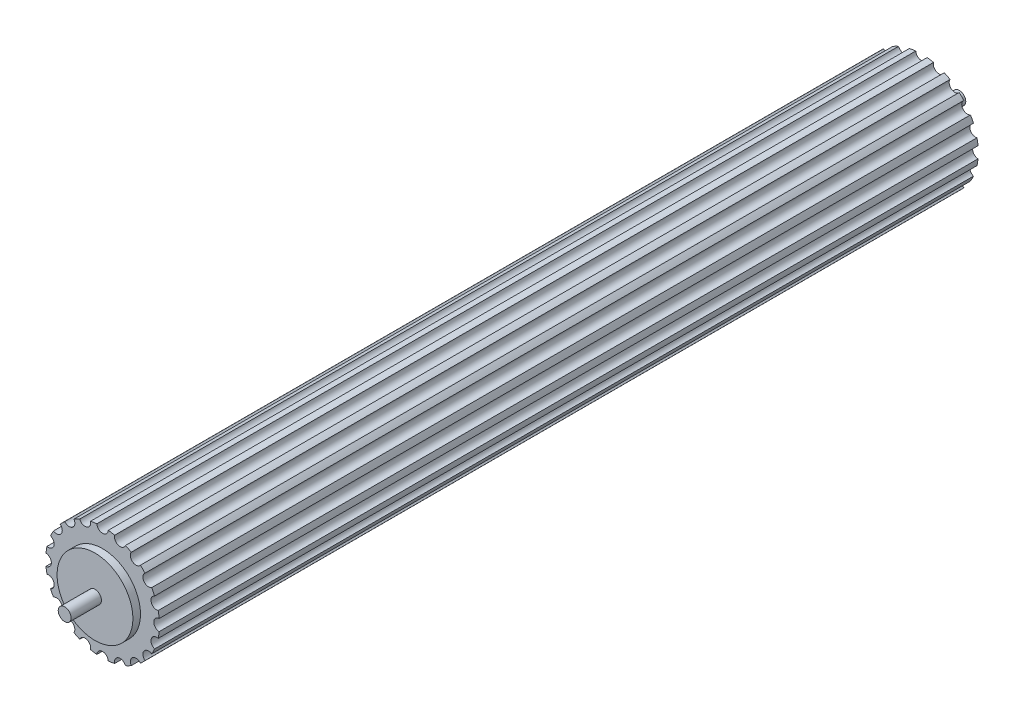
from build123d import *

# Parameters (mm, degrees)
IZIM1_R                     = 75
Y_KSEKLIK_EKSTR_ZYON1_DEPTH = 1080
IZIM2_R                     = 8.5
Y_KSEKLIK_EKSTR_ZYON2_DEPTH = 50
IZIM3_R                     = 50
Y_KSEKLIK_EKSTR_ZYON3_DEPTH = 10
IZIM4_R                     = 7.5
KES_EKSTR_ZYON1_DEPTH       = 1135.966959872
DAIRESEL_KAPLAMA1_COUNT     = 20


with BuildPart() as part:
    # Çizim1 → Yükseklik-Ekstrüzyon1 (new body)
    with BuildSketch(Plane.XY):
        Circle(IZIM1_R)
    extrude(amount=Y_KSEKLIK_EKSTR_ZYON1_DEPTH)

    # Çizim2 → Yükseklik-Ekstrüzyon2 (add)
    with BuildSketch(Plane.XY.offset(1080)):
        Circle(IZIM2_R)
    y_kseklik_ekstr_zyon2 = extrude(amount=Y_KSEKLIK_EKSTR_ZYON2_DEPTH)

    # Aynalama1: Yükseklik-Ekstrüzyon2 across plane
    add(y_kseklik_ekstr_zyon2.mirror(Plane.XY.offset(540)))

    # Çizim3 → Yükseklik-Ekstrüzyon3 (add)
    with BuildSketch(Plane.XY.offset(1080)):
        Circle(IZIM3_R)
    y_kseklik_ekstr_zyon3 = extrude(amount=Y_KSEKLIK_EKSTR_ZYON3_DEPTH)

    # Aynalama2: Yükseklik-Ekstrüzyon3 across plane
    add(y_kseklik_ekstr_zyon3.mirror(Plane.XY.offset(540)))

    # Çizim4 → Kes-Ekstrüzyon1 (cut, through all)
    with BuildSketch(Plane.XY.offset(1080)):
        with Locations((0, 75)):
            Circle(IZIM4_R)
    kes_ekstr_zyon1 = extrude(amount=-KES_EKSTR_ZYON1_DEPTH, mode=Mode.SUBTRACT)

    # Dairesel Kaplama1: Kes-Ekstrüzyon1 ×20 about axis
    dairesel_kaplama1_axis = Axis((0, 0, 1080), (0, 0, -1))
    for i in range(1, DAIRESEL_KAPLAMA1_COUNT):
        add(kes_ekstr_zyon1.rotate(dairesel_kaplama1_axis, i * 360 / DAIRESEL_KAPLAMA1_COUNT), mode=Mode.SUBTRACT)


solid = part.part
